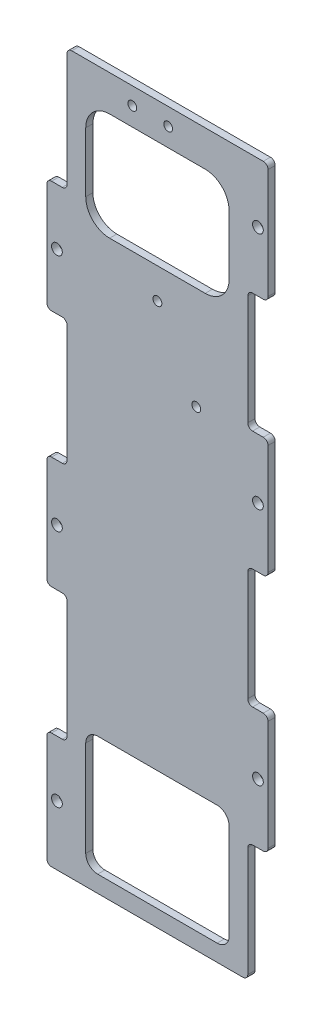
from build123d import *

# Parameters (mm, degrees)
SKETCH1_W           = 92.6
SKETCH1_H           = 300
BOSS_EXTRUDE1_DEPTH = 3
SKETCH2_R           = 2.25
SKETCH2_W           = 8.48
SKETCH2_H           = 51.5
SKETCH2_H_2         = 50
SKETCH2_H_3         = 53
CUT_EXTRUDE1_DEPTH  = 10
FILLET1_R           = 2
CUT_EXTRUDE3_DEPTH  = 8.5
SKETCH5_R           = 1.85
CUT_EXTRUDE4_DEPTH  = 10
SKETCH6_R           = 1.85
CUT_EXTRUDE5_DEPTH  = 10


with BuildPart() as part:
    # Sketch1 → Boss-Extrude1 (new body)
    with BuildSketch(Plane.XY):
        Rectangle(SKETCH1_W, SKETCH1_H)
    extrude(amount=BOSS_EXTRUDE1_DEPTH)

    # Sketch2 → Cut-Extrude1 (cut)
    with BuildSketch(Plane.XY):
        with Locations((-42.06, 75)):
            Circle(SKETCH2_R)
        with Locations((42.06, 125)):
            Circle(SKETCH2_R)
        with Locations((42.06, 25)):
            Circle(SKETCH2_R)
        with Locations((42.06, -75)):
            Circle(SKETCH2_R)
        with Locations((-42.06, -25)):
            Circle(SKETCH2_R)
        with Locations((-42.06, -125)):
            Circle(SKETCH2_R)
        with Locations((-42.06, 124.25)):
            Rectangle(SKETCH2_W, SKETCH2_H)
        with Locations((42.06, 75)):
            Rectangle(SKETCH2_W, SKETCH2_H_2)
        with Locations((42.06, -25)):
            Rectangle(SKETCH2_W, SKETCH2_H_2)
        with Locations((-42.06, 25)):
            Rectangle(SKETCH2_W, SKETCH2_H_3)
        with Locations((-42.06, -75)):
            Rectangle(SKETCH2_W, SKETCH2_H_3)
        with Locations((42.06, -125)):
            Rectangle(SKETCH2_W, SKETCH2_H_2)
    extrude(amount=CUT_EXTRUDE1_DEPTH, mode=Mode.SUBTRACT)

    # Fillet1
    fillet1_edges = [part.edges().sort_by_distance(p)[0] for p in [
        (46.3, -100, 1.5),
        (37.82, -100, 1.5),
        (37.82, -150, 1.5),
        (46.3, 50, 1.5),
        (46.3, 100, 1.5),
        (37.82, 100, 1.5),
        (37.82, 50, 1.5),
        (-46.3, -48.5, 1.5),
        (-46.3, -101.5, 1.5),
        (-37.82, -101.5, 1.5),
        (-37.82, -48.5, 1.5),
        (37.82, 0, 1.5),
        (37.82, -50, 1.5),
        (46.3, -50, 1.5),
        (46.3, 0, 1.5),
        (46.3, 150, 1.5),
        (-46.3, 51.5, 1.5),
        (-46.3, -150, 1.5),
        (-46.3, -1.5, 1.5),
        (-37.82, -1.5, 1.5),
        (-37.82, 51.5, 1.5),
        (-46.3, 98.5, 1.5),
        (-37.82, 98.5, 1.5),
        (-37.82, 150, 1.5),
    ]]
    fillet(fillet1_edges, radius=FILLET1_R)

    # Sketch4 → Cut-Extrude3 (cut)
    with BuildSketch(Plane(origin=(0, 0, 0), x_dir=(-1, 0, 0), z_dir=(0, 0, -1))):
        with BuildLine():
            Line((20, 90), (-20, 90))
            ThreePointArc((-20, 90), (-27.071067812, 92.928932188), (-30, 100))
            Line((-30, 100), (-30, 125))
            ThreePointArc((-30, 125), (-27.071067812, 132.071067812), (-20, 135))
            Line((-20, 135), (20, 135))
            ThreePointArc((20, 135), (27.071067812, 132.071067812), (30, 125))
            Line((30, 125), (30, 100))
            ThreePointArc((30, 100), (27.071067812, 92.928932188), (20, 90))
        make_face()
        with BuildLine():
            Line((25, -143), (-25, -143))
            ThreePointArc((-25, -143), (-28.535533906, -141.535533906), (-30, -138))
            Line((-30, -138), (-30, -98))
            ThreePointArc((-30, -98), (-28.535533906, -94.464466094), (-25, -93))
            Line((-25, -93), (25, -93))
            ThreePointArc((25, -93), (28.535533906, -94.464466094), (30, -98))
            Line((30, -98), (30, -138))
            ThreePointArc((30, -138), (28.535533906, -141.535533906), (25, -143))
        make_face()
    extrude(amount=-CUT_EXTRUDE3_DEPTH, mode=Mode.SUBTRACT)

    # Sketch5 → Cut-Extrude4 (cut)
    with BuildSketch(Plane(origin=(0, 0, 0), x_dir=(-1, 0, 0), z_dir=(0, 0, -1))):
        with Locations((0, 77.2)):
            Circle(SKETCH5_R)
        with Locations((-16.25, 47)):
            Circle(SKETCH5_R)
    extrude(amount=-CUT_EXTRUDE4_DEPTH, mode=Mode.SUBTRACT)

    # Sketch6 → Cut-Extrude5 (cut)
    with BuildSketch(Plane(origin=(0, 0, 0), x_dir=(-1, 0, 0), z_dir=(0, 0, -1))):
        with Locations((-4.5, 142.75)):
            Circle(SKETCH6_R)
        with Locations((10.5, 142.75)):
            Circle(SKETCH6_R)
    extrude(amount=-CUT_EXTRUDE5_DEPTH, mode=Mode.SUBTRACT)


solid = part.part
